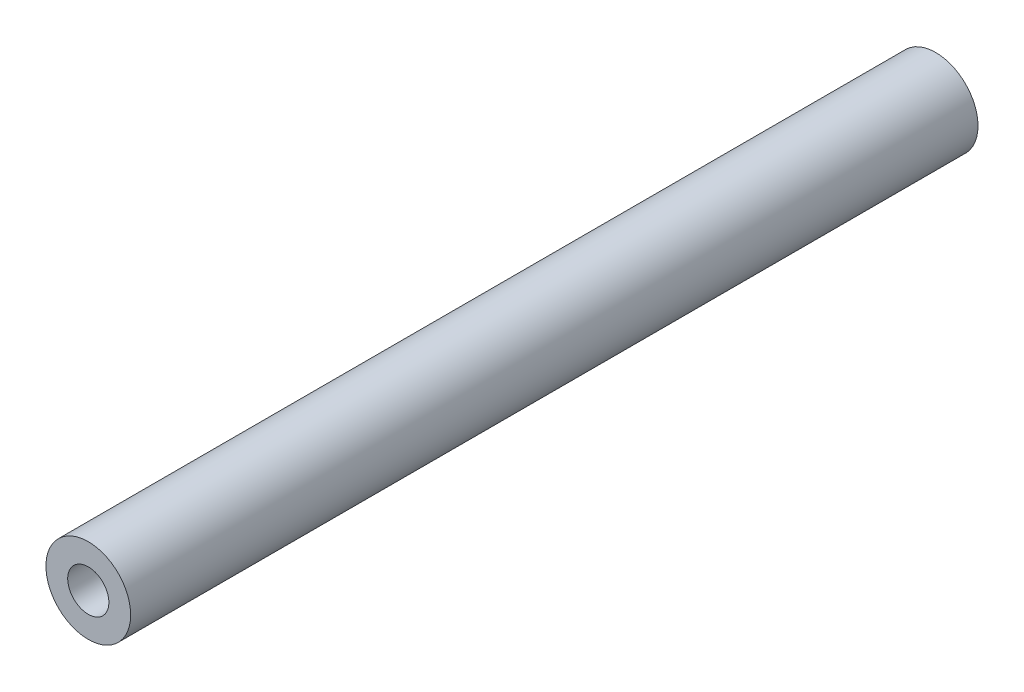
from build123d import *

# Parameters (mm, degrees)
SKETCH1_R           = 3.5
SKETCH1_R_2         = 1.7
BOSS_EXTRUDE1_DEPTH = 70


with BuildPart() as part:
    # Sketch1 → Boss-Extrude1 (new body)
    with BuildSketch(Plane.XY):
        with Locations((169.638438212, -7.233826143)):
            Circle(SKETCH1_R)
        with Locations((169.638438212, -7.233826143)):
            Circle(SKETCH1_R_2, mode=Mode.SUBTRACT)
    extrude(amount=BOSS_EXTRUDE1_DEPTH)


solid = part.part
